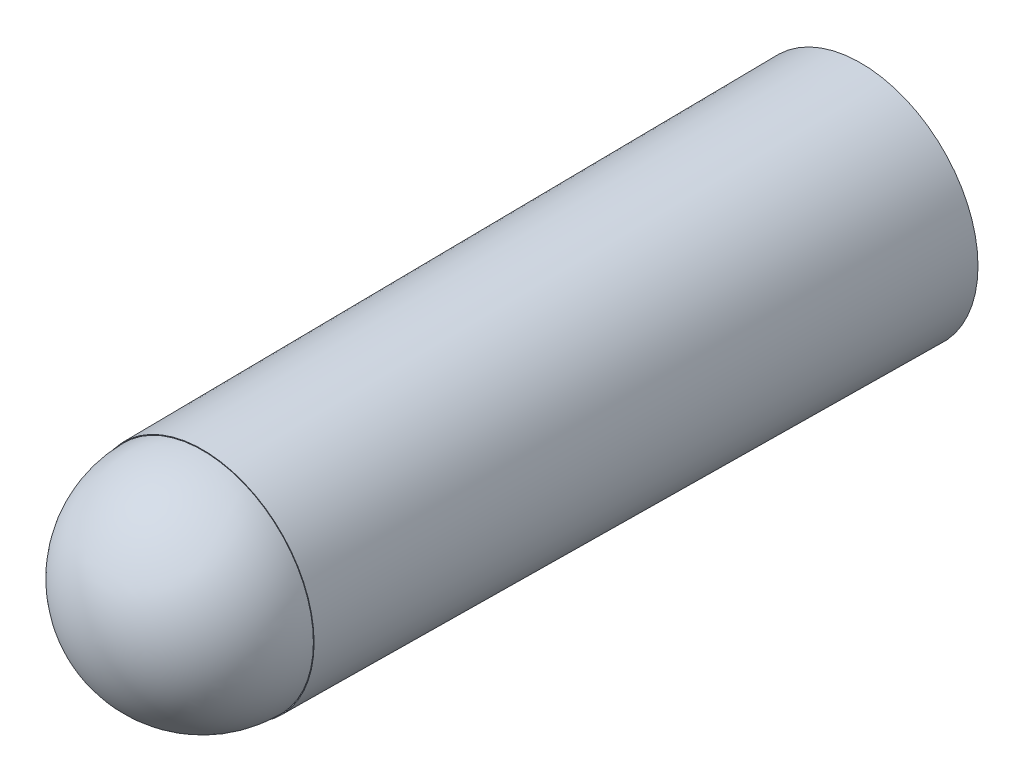
from build123d import *

# Parameters (mm, degrees)
SKETCH1_R           = 44.55
BOSS_EXTRUDE1_DEPTH = 250
BOSS_EXTRUDE1_TAPER = 0.5


with BuildPart() as part:
    # Sketch1 → Boss-Extrude1 (new body)
    with BuildSketch(Plane.XY):
        Circle(SKETCH1_R)
    extrude(amount=BOSS_EXTRUDE1_DEPTH, taper=BOSS_EXTRUDE1_TAPER)

    # Sketch2 → Cut-Revolve1 (revolve, cut)
    with BuildSketch(Plane(origin=(0, 0, 0), x_dir=(-1, 0, 0), z_dir=(0, 0, -1))):
        with BuildLine():
            Line((0, 39.55), (0, -39.55))
            ThreePointArc((0, -39.55), (39.55, 0), (0, 39.55))
        make_face()
    revolve(axis=Axis((0, 39.55, 0), (0, -1, 0)), mode=Mode.SUBTRACT)

    # Sketch3 → Revolve1 (revolve)
    with BuildSketch(Plane.XY.offset(250)):
        with BuildLine():
            Line((0, 42.106477019), (0, -42.106477019))
            ThreePointArc((0, -42.106477019), (-42.106477019, 0), (0, 42.106477019))
        make_face()
    revolve(axis=Axis((0, 42.106477019, 250), (0, -1, 0)))


solid = part.part
